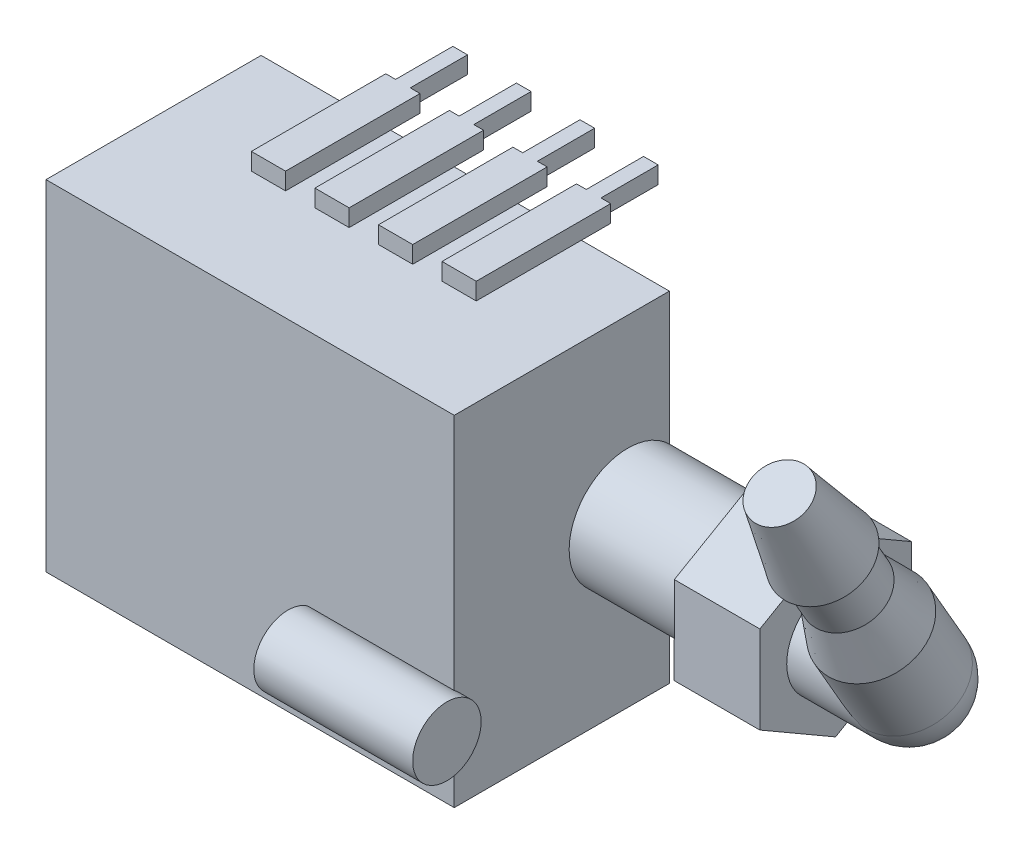
from build123d import *

# Parameters (mm, degrees)
ESQUISSE1_W                = 16.7
ESQUISSE1_H                = 13.9
EXTRUSION1_DEPTH           = 8.8
EXTRUSION2_DEPTH           = 0.5
EXTRUSION2_DEPTH_BACK      = 6
ESQUISSE2_R                = 1.4
ESQUISSE3_R                = 2.4
EXTRUSION3_DEPTH           = 5
EXTRUSION4_DEPTH           = 3.5
ESQUISSE5_R                = 2
EXTRUSION5_DEPTH           = 5
CONG_1_R                   = 2
ESQUISSE6_R                = 2
EXTRUSION6_DEPTH           = 3
EXTRUSION6_OTHER_WAY_DEPTH = 2
EXTRUSION6_OTHER_WAY_TAPER = 15
ESQUISSE7_R                = 1.464101615
EXTRUSION7_DEPTH           = 2
ESQUISSE8_R                = 1.75
EXTRUSION8_DEPTH           = 3.5
EXTRUSION8_TAPER           = 10
EXTRUSION9_DEPTH           = 0.7
EXTRUSION10_DEPTH          = 0.7


with BuildPart() as part:
    # Esquisse1 → Extrusion1 (new body)
    with BuildSketch(Plane.XY):
        with Locations((0.361659441, 0.162554307)):
            Rectangle(ESQUISSE1_W, ESQUISSE1_H)
    extrude(amount=-EXTRUSION1_DEPTH)

    # Esquisse2 → Extrusion2 (add, two sides: drawn at the far end of the back side and taken through both)
    with BuildSketch(Plane(origin=(8.711659441, 0, 0), x_dir=(0, 0, -1), z_dir=(1, 0, 0)).offset(-EXTRUSION2_DEPTH_BACK)):
        with Locations((-0.8, -3.787445693)):
            Circle(ESQUISSE2_R)
    extrude(amount=EXTRUSION2_DEPTH + EXTRUSION2_DEPTH_BACK)

    # Esquisse3 → Extrusion3 (add)
    with BuildSketch(Plane(origin=(8.711659441, 0, 0), x_dir=(0, 0, -1), z_dir=(1, 0, 0))):
        with Locations(Location((7.1, 0, 0), (0, 0, 315.099472039))):
            Circle(ESQUISSE3_R)
    extrude(amount=EXTRUSION3_DEPTH)

    # Esquisse4 → Extrusion4 (add)
    with BuildSketch(Plane(origin=(13.711659441, 0, 0), x_dir=(0, 0, -1), z_dir=(1, 0, 0))):
        Polygon((10.198101751, -1.793069678), (10.201894768, 1.786499981), (7.103793016, 3.579569659), (4.001898249, 1.793069678), (3.998105232, -1.786499981), (7.096206984, -3.579569659), align=None)
    extrude(amount=EXTRUSION4_DEPTH)

    # Esquisse5 → Extrusion5 (add)
    with BuildSketch(Plane(origin=(17.211659441, 0, 0), x_dir=(0, 0, -1), z_dir=(1, 0, 0))):
        with Locations(Location((7.1, 0, 0), (0, 0, 180))):
            Circle(ESQUISSE5_R)
    extrude(amount=EXTRUSION5_DEPTH)

    # Congé1
    cong_1_edges = [part.edges().sort_by_distance(p)[0] for p in [
        (22.211659441, 0, -9.1),
    ]]
    fillet(cong_1_edges, radius=CONG_1_R)

    # Esquisse6 → Extrusion6 (add)
    with BuildSketch(Plane(origin=(0, -0.384301931, -0.221334199), x_dir=(-1, 0, 0), z_dir=(0, 0.866554731886771, 0.4990820540198241))):
        with Locations(Location((-20.211659441, -6.152538596, 0), (0, 0, 90))):
            Circle(ESQUISSE6_R)
    extrude(amount=-EXTRUSION6_DEPTH)

    # Esquisse6 → Extrusion6 other way (add)
    with BuildSketch(Plane(origin=(0, -0.384301931, -0.221334199), x_dir=(-1, 0, 0), z_dir=(0, 0.866554731886771, 0.4990820540198241))):
        with Locations(Location((-20.211659441, -6.152538596, 0), (0, 0, 90))):
            Circle(ESQUISSE6_R)
    extrude(amount=EXTRUSION6_OTHER_WAY_DEPTH, taper=EXTRUSION6_OTHER_WAY_TAPER)

    # Esquisse7 → Extrusion7 (add)
    with BuildSketch(Plane(origin=(0, 1.348807532, 0.776829909), x_dir=(-1, 0, 0), z_dir=(0, 0.866554731886771, 0.4990820540198242))):
        with Locations(Location((-20.211659441, -6.152538596, 0), (0, 0, 90))):
            Circle(ESQUISSE7_R)
    extrude(amount=EXTRUSION7_DEPTH)

    # Esquisse8 → Extrusion8 (add)
    with BuildSketch(Plane(origin=(0, 3.081916996, 1.774994017), x_dir=(-1, 0, 0), z_dir=(0, 0.8665547318867707, 0.4990820540198243))):
        with Locations((-20.211659441, -6.152538596)):
            Circle(ESQUISSE8_R)
    extrude(amount=EXTRUSION8_DEPTH, taper=EXTRUSION8_TAPER)

    # Esquisse9 → Extrusion9 (add)
    with BuildSketch(Plane.XZ.offset(6.787445693)):
        Polygon((5.111659441, -4.5), (5.111659441, -10), (4.711659441, -10), (4.711659441, -12.342565152), (4.111659441, -12.342565152), (4.111659441, -10), (3.711659441, -10), (3.711659441, -4.5), align=None)
        Polygon((2.511659441, -4.5), (2.511659441, -10), (2.111659441, -10), (2.111659441, -12.342565152), (1.511659441, -12.342565152), (1.511659441, -10), (1.111659441, -10), (1.111659441, -4.5), align=None)
        Polygon((-0.088340559, -4.5), (-0.088340559, -10), (-0.488340559, -10), (-0.488340559, -12.342565152), (-1.088340559, -12.342565152), (-1.088340559, -10), (-1.488340559, -10), (-1.488340559, -4.5), align=None)
        Polygon((-2.688340559, -4.5), (-2.688340559, -10), (-3.088340559, -10), (-3.088340559, -12.342565152), (-3.688340559, -12.342565152), (-3.688340559, -10), (-4.088340559, -10), (-4.088340559, -4.5), align=None)
    extrude(amount=EXTRUSION9_DEPTH)

    # Esquisse10 → Extrusion10 (add)
    with BuildSketch(Plane(origin=(0, 7.112554307, 0), x_dir=(-1, 0, 0), z_dir=(0, 1, 0))):
        Polygon((0.088340559, -4.5), (0.088340559, -10), (0.488340559, -10), (0.488340559, -12.342565152), (1.088340559, -12.342565152), (1.088340559, -10), (1.488340559, -10), (1.488340559, -4.5), align=None)
        Polygon((-2.511659441, -10), (-2.111659441, -10), (-2.111659441, -12.342565152), (-1.511659441, -12.342565152), (-1.511659441, -10), (-1.111659441, -10), (-1.111659441, -4.5), (-2.511659441, -4.5), align=None)
        Polygon((-4.711659441, -10), (-4.711659441, -12.342565152), (-4.111659441, -12.342565152), (-4.111659441, -10), (-3.711659441, -10), (-3.711659441, -4.5), (-5.111659441, -4.5), (-5.111659441, -10), align=None)
        Polygon((2.688340559, -4.5), (2.688340559, -10), (3.088340559, -10), (3.088340559, -12.342565152), (3.688340559, -12.342565152), (3.688340559, -10), (4.088340559, -10), (4.088340559, -4.5), align=None)
    extrude(amount=EXTRUSION10_DEPTH)


solid = part.part
